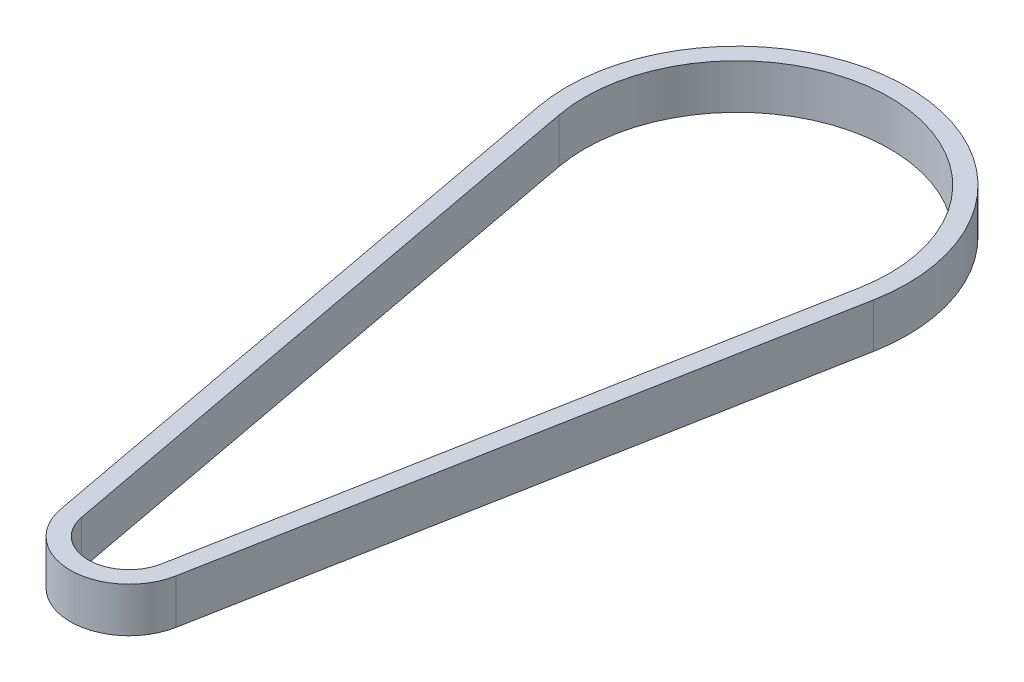
from build123d import *

# Parameters (mm, degrees)
BOSS_EXTRUDE1_DEPTH = 50


with BuildPart() as part:
    # Sketch1 → Boss-Extrude1 (new body)
    with BuildSketch(Plane(origin=(0, 0, 0), x_dir=(1, 0, 0), z_dir=(0, 1, 0))):
        with BuildLine():
            Line((-187.507179986, -35.023134548), (-64.632225867, -692.872194477))
            ThreePointArc((-64.632225867, -692.872194477), (0, -746.55), (64.632225867, -692.872194477))
            Line((64.632225867, -692.872194477), (187.507179986, -35.023134548))
            ThreePointArc((187.507179986, -35.023134548), (0, 190.75), (-187.507179986, -35.023134548))
        make_face()
        with BuildLine():
            ThreePointArc((-44.972233208, -689.200044066), (0, -726.55), (44.972233208, -689.200044066))
            Line((44.972233208, -689.200044066), (167.847187327, -31.350984136))
            ThreePointArc((167.847187327, -31.350984136), (0, 170.75), (-167.847187327, -31.350984136))
            Line((-167.847187327, -31.350984136), (-44.972233208, -689.200044066))
        make_face(mode=Mode.SUBTRACT)
    extrude(amount=BOSS_EXTRUDE1_DEPTH)


solid = part.part
